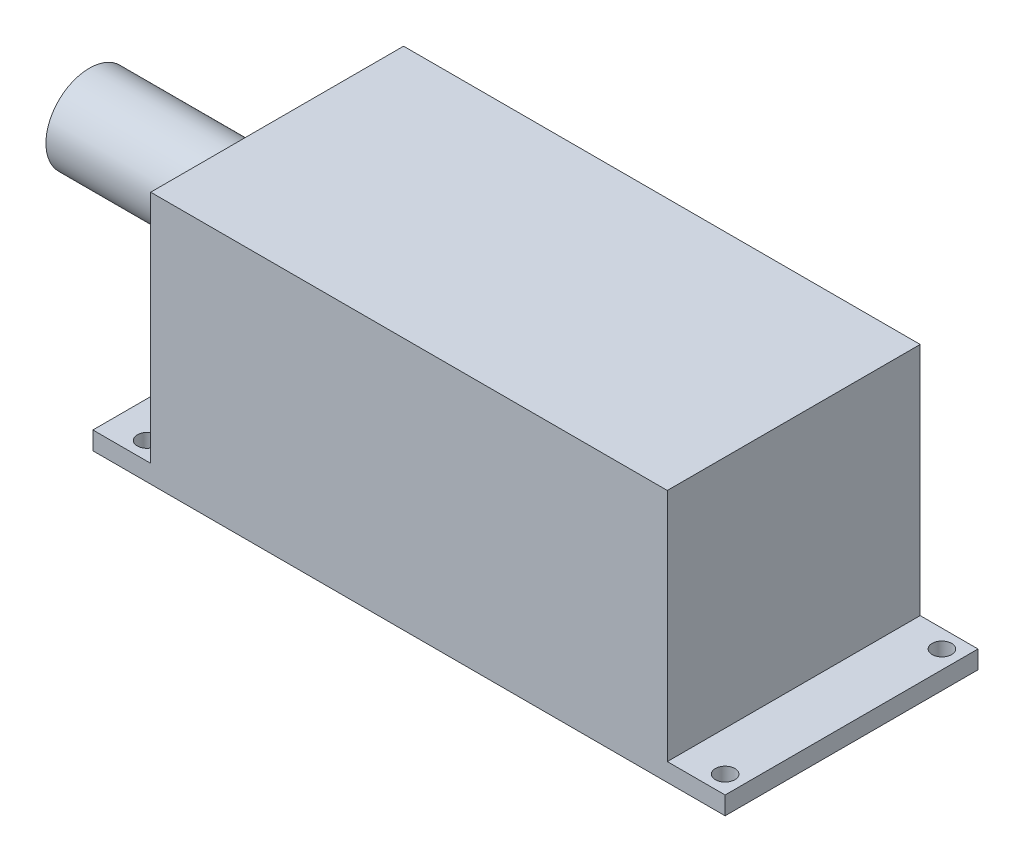
from build123d import *

# Parameters (mm, degrees)
SKETCH1_W           = 222.25
SKETCH1_H           = 88.9
BOSS_EXTRUDE1_DEPTH = 88.9
SKETCH4_W           = 20.32
SKETCH4_H           = 88.9
CUT_EXTRUDE1_DEPTH  = 82.55
SKETCH2_W           = 156.845
SKETCH2_H           = 15.24
SKETCH5_R           = 3.429
CUT_EXTRUDE2_DEPTH  = 183.731111267


with BuildPart() as part:
    # Sketch1 → Boss-Extrude1 (new body)
    with BuildSketch(Plane(origin=(0, 0, 0), x_dir=(1, 0, 0), z_dir=(0, 1, 0))):
        Rectangle(SKETCH1_W, SKETCH1_H)
    extrude(amount=BOSS_EXTRUDE1_DEPTH)

    # Sketch4 → Cut-Extrude1 (cut)
    with BuildSketch(Plane(origin=(0, 88.9, 0), x_dir=(1, 0, 0), z_dir=(0, 1, 0))):
        with Locations((-100.965, 0)):
            Rectangle(SKETCH4_W, SKETCH4_H)
        with Locations((100.965, 0)):
            Rectangle(SKETCH4_W, SKETCH4_H)
    extrude(amount=-CUT_EXTRUDE1_DEPTH, mode=Mode.SUBTRACT)

    # Sketch2 → Revolve1 (revolve)
    with BuildSketch(Plane(origin=(0, 56.1594, 0), x_dir=(1, 0, 0), z_dir=(0, 1, 0))):
        with Locations((-78.4225, 7.62)):
            Rectangle(SKETCH2_W, SKETCH2_H)
    revolve(axis=Axis((0, 56.1594, 0), (-1, 0, 0)))

    # Sketch5 → Cut-Extrude2 (cut, through all)
    with BuildSketch(Plane(origin=(0, 6.35, 0), x_dir=(1, 0, 0), z_dir=(0, 1, 0))):
        with Locations(Location((-98.425, 38.1, 0), (0, 0, 270))):
            Circle(SKETCH5_R)
        with Locations(Location((104.775, 38.1, 0), (0, 0, 270))):
            Circle(SKETCH5_R)
        with Locations(Location((104.775, -38.1, 0), (0, 0, 270))):
            Circle(SKETCH5_R)
        with Locations(Location((-98.425, -38.1, 0), (0, 0, 270))):
            Circle(SKETCH5_R)
    extrude(amount=-CUT_EXTRUDE2_DEPTH, mode=Mode.SUBTRACT)


solid = part.part
